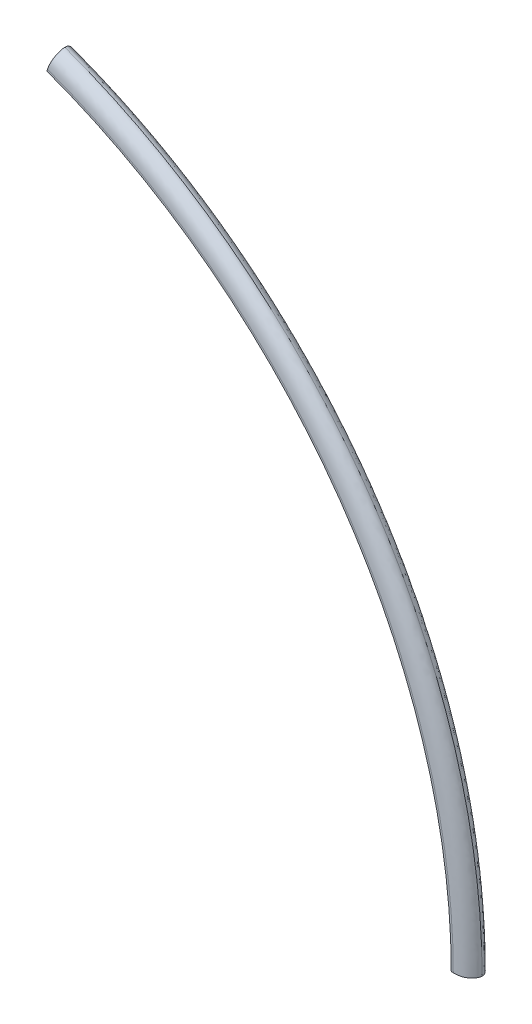
from build123d import *


with BuildPart() as part:
    # 扫描1: sweep along a path in 草图1
    with BuildLine(Plane.XY) as sweep_1_path:
        ThreePointArc((213, 0), (174.479385434, 122.171780943), (72.850290528, 200.154528227))
    # 草图2 → 扫描1 (sweep)
    with BuildSketch(Plane(origin=(213, 0, 0), x_dir=(1, 0, 0), z_dir=(0, 1, 0))):
        with BuildLine():
            Line((0.35, -3), (-0.35, -3))
            Line((-0.35, -3), (-0.35, 3))
            Line((-0.35, 3), (0.35, 3))
            Line((0.35, 3), (0.35, 4))
            Line((0.35, 4), (1.05, 4))
            add(Edge.make_bspline(
                [(1.05, 4), (4.166947154, 4), (5.659846142, 2.669828561), (7.05, 0.890470727), (7.05, 0)],
                knots=[0, 0, 0, 0, 0.756596425, 1, 1, 1, 1], degree=3))
            add(Edge.make_bspline(
                [(1.05, -4), (4.166947154, -4), (5.659846142, -2.669828561), (7.05, -0.890470727), (7.05, 0)],
                knots=[0, 0, 0, 0, 0.756596425, 1, 1, 1, 1], degree=3))
            Line((1.05, -4), (0.35, -4))
            Line((0.35, -4), (0.35, -3))
        make_face()
    sweep(path=sweep_1_path.line)


solid = part.part
